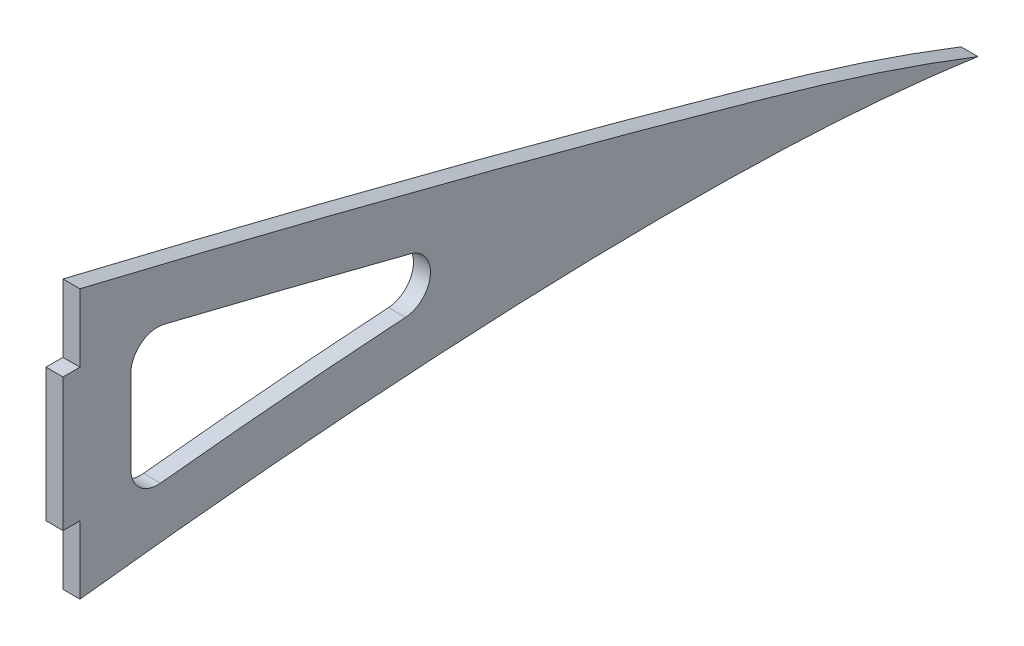
from build123d import *

# Parameters (mm, degrees)
BOSS_EXTRUDE1_DEPTH     = 1.5875
CUT_EXTRUDE2_DEPTH      = 785.578740099
CUT_EXTRUDE2_DEPTH_BACK = 785.578740099
FILLET2_R               = 5


with BuildPart() as part:
    # Sketch1 → Boss-Extrude1 (new, symmetric)
    with BuildSketch(Plane(origin=(0, 0, 0), x_dir=(0, 0, -1), z_dir=(1, 0, 0))):
        with BuildLine():
            add(Edge.make_bspline(
                [(784.106482277, -23.118423177), (780.160330067, -21.594194865), (772.229019431, -18.642031364), (760.174514143, -14.672159257), (747.991113763, -11.061270892), (731.645658465, -6.455954447), (711.176791695, -0.845295729), (679.558994763, 7.487552705), (651.983641844, 14.499561744), (628.478216713, 20.27753038), (620.224641654, 22.275465986), (616.096053399, 23.266700138)],
                knots=[0.02229965, 0.02229965, 0.02229965, 0.02229965, 0.037574888, 0.052850126, 0.068125363, 0.083400601, 0.113951077, 0.144501553, 0.201029282, 0.21630452, 0.231579758, 0.231579758, 0.231579758, 0.231579758], degree=3))
            Line((616.096053399, 23.266700138), (616.096053399, 10.566700138))
            Line((616.096053399, 10.566700138), (612.921053399, 10.566700138))
            Line((612.921053399, 10.566700138), (612.921053399, -14.332259955))
            Line((612.921053399, -14.332259955), (616.096053399, -14.332259955))
            Line((616.096053399, -14.332259955), (616.096053399, -27.032259955))
            add(Edge.make_bspline(
                [(616.096053399, -27.032259955), (620.425080515, -26.520992099), (641.501106895, -24.130719251), (671.327266418, -21.474905507), (705.603952791, -19.816296976), (731.789031329, -19.412207677), (758.000345874, -20.150218902), (775.446944988, -21.867269156), (784.106482277, -23.118423177)],
                knots=[0.781625681, 0.781625681, 0.781625681, 0.781625681, 0.796909794, 0.855992653, 0.886560878, 0.917129102, 0.947697327, 0.978265551, 0.978265551, 0.978265551, 0.978265551], degree=3))
        make_face()
    extrude(amount=BOSS_EXTRUDE1_DEPTH, both=True)

    # Sketch3 → Cut-Extrude2 (cut, two sides: drawn at the far end of the back side and taken through both)
    with BuildSketch(Plane.ZY.offset(1.5875).offset(-CUT_EXTRUDE2_DEPTH_BACK)):
        with BuildLine():
            add(Edge.make_bspline(
                [(-709.553781789, -10.315598481), (-702.586088902, -8.439955555), (-688.640319728, -4.750192135), (-667.656705928, 0.677236447), (-646.655315148, 5.990494954), (-632.636020902, 9.452460216), (-625.621053399, 11.162422894)],
                knots=[0.0368347, 0.0368347, 0.0368347, 0.0368347, 0.062876694, 0.088918688, 0.114960682, 0.141002675, 0.141002675, 0.141002675, 0.141002675], degree=3))
            Line((-625.621053399, 11.162422894), (-625.621053399, 10.566700138))
            Line((-625.621053399, 10.566700138), (-625.621053399, -14.332259955))
            Line((-625.621053399, -14.332259955), (-625.621053399, -16.357533681))
            add(Edge.make_bspline(
                [(-625.621053399, -16.357533681), (-632.578353092, -15.590470377), (-646.498309301, -14.164913642), (-667.45488798, -12.400335024), (-688.462893644, -11.065289582), (-702.525237077, -10.501699929), (-709.553781789, -10.315598481)],
                knots=[0.868429492, 0.868429492, 0.868429492, 0.868429492, 0.892780479, 0.917131465, 0.941482452, 0.965833439, 0.965833439, 0.965833439, 0.965833439], degree=3))
        make_face()
    extrude(amount=CUT_EXTRUDE2_DEPTH + CUT_EXTRUDE2_DEPTH_BACK, mode=Mode.SUBTRACT)

    # Fillet2
    fillet2_edges = [part.edges().sort_by_distance(p)[0] for p in [
        (0, 11.162422894, -625.621053399),
        (0, -16.357533681, -625.621053399),
        (0, -10.315598481, -709.553781789),
    ]]
    fillet(fillet2_edges, radius=FILLET2_R)


solid = part.part
